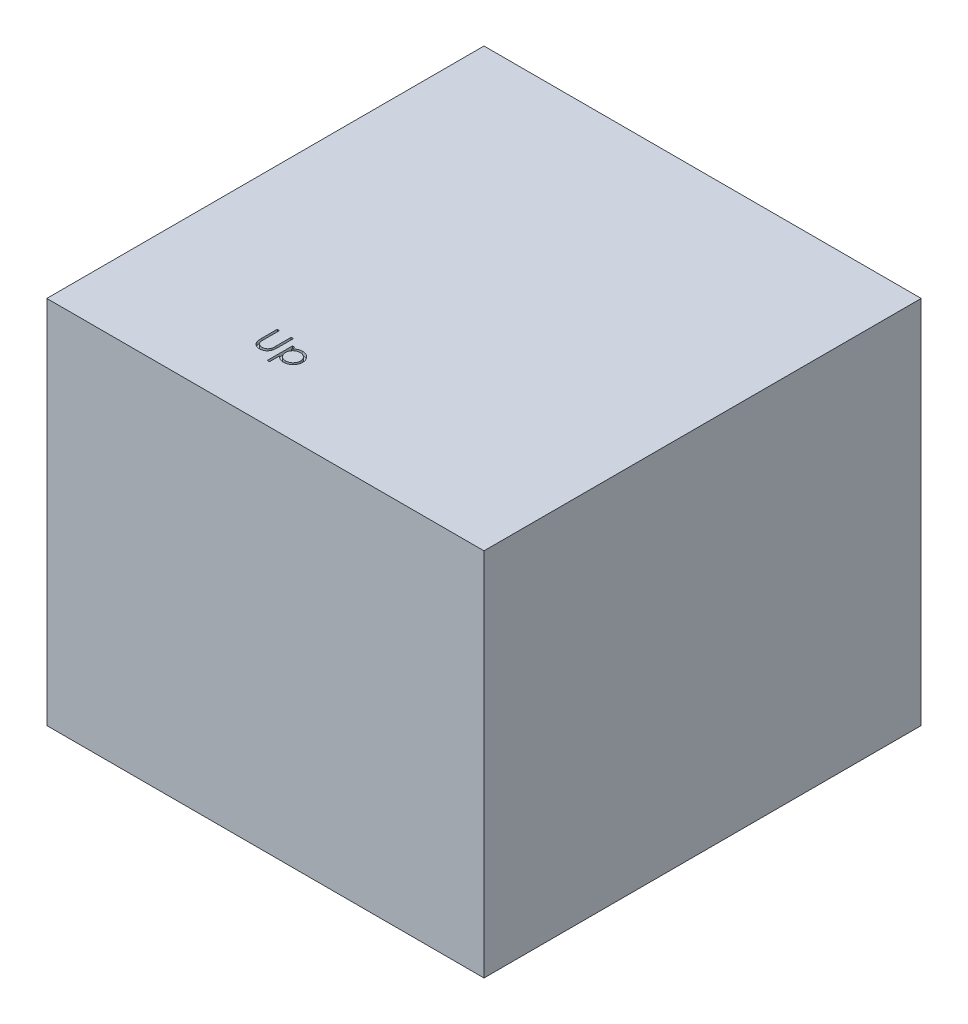
from build123d import *

# Parameters (mm, degrees)
SKETCH1_W           = 330.2
SKETCH1_H           = 330.2
BOSS_EXTRUDE1_DEPTH = 279.4
CUT_EXTRUDE1_DEPTH  = 2.54


with BuildPart() as part:
    # Sketch1 → Boss-Extrude1 (new body)
    with BuildSketch(Plane(origin=(0, 0, 0), x_dir=(1, 0, 0), z_dir=(0, 1, 0))):
        Rectangle(SKETCH1_W, SKETCH1_H)
    extrude(amount=BOSS_EXTRUDE1_DEPTH)

    # Sketch2 → Cut-Extrude1 (cut)
    # profile 1 of 2: a face of its own
    with BuildSketch(Plane(origin=(0, 279.4, 0), x_dir=(1, 0, 0), z_dir=(0, 1, 0))):
        with BuildLine():
            Line((-57.888961079, -98.222414931), (-56.179345694, -98.222414931))
            Line((-56.179345694, -98.222414931), (-56.179345694, -109.636387287))
            add(Edge.make_bspline(
                [(-56.179345694, -109.636387287), (-56.179600115, -109.797935292), (-56.180082922, -110.10450047), (-56.176857954, -110.540845077), (-56.167826249, -110.92877089), (-56.162132152, -111.269773224), (-56.149464808, -111.562287321), (-56.13913401, -111.807897941), (-56.125850408, -112.0054421), (-56.109885869, -112.120726855), (-56.103023579, -112.170281518)],
                knots=[0, 0, 0, 0, 1.528628734, 2.90083645, 4.128790002, 5.200304208, 6.127813768, 6.898992206, 7.526736466, 8, 8, 8, 8], degree=3))
            add(Edge.make_bspline(
                [(-56.103023579, -112.170281518), (-56.07484341, -112.349061758), (-56.020070925, -112.696548613), (-55.880481354, -113.191349404), (-55.685531813, -113.637290627), (-55.454520395, -114.048287797), (-55.150087182, -114.412901314), (-54.785396511, -114.748789024), (-54.343557514, -115.042549846), (-53.852281931, -115.311159265), (-53.322772282, -115.527050642), (-52.78169096, -115.690300239), (-52.237171317, -115.789789679), (-51.872629618, -115.801309699), (-51.69160531, -115.807030316)],
                knots=[0, 0, 0, 0, 1.035780045, 2.013197591, 2.933192213, 3.817615948, 4.702609284, 5.640816605, 6.646850145, 7.73207398, 8.84249596, 9.914020372, 10.964143139, 12, 12, 12, 12], degree=3))
            add(Edge.make_bspline(
                [(-51.69160531, -115.807030316), (-51.53619138, -115.801185502), (-51.22626115, -115.789529633), (-50.765760435, -115.717349558), (-50.317268415, -115.587262194), (-49.878570428, -115.419405794), (-49.467357213, -115.197622477), (-49.083399336, -114.941422622), (-48.740695637, -114.640917711), (-48.427959963, -114.308357265), (-48.155626955, -113.933127782), (-47.919564027, -113.523399631), (-47.726201467, -113.073006757), (-47.630714567, -112.756480544), (-47.581659396, -112.593869258)],
                knots=[0, 0, 0, 0, 0.994687771, 1.983630487, 2.973142513, 3.978332533, 4.983357753, 5.956394766, 6.925816176, 7.893390482, 8.871859704, 9.88551698, 10.913711441, 12, 12, 12, 12], degree=3))
            add(Edge.make_bspline(
                [(-47.581659396, -112.593869258), (-47.565330143, -112.526657732), (-47.528941986, -112.376883366), (-47.494940212, -112.123674627), (-47.459526124, -111.824919661), (-47.434953964, -111.478471937), (-47.41099875, -111.085492357), (-47.396667311, -110.643933727), (-47.390043175, -110.155399412), (-47.388069158, -109.814474289), (-47.387038002, -109.636387287)],
                knots=[0, 0, 0, 0, 0.558680831, 1.244966039, 2.062412453, 2.990489873, 4.051219941, 5.244515665, 6.560634259, 8, 8, 8, 8], degree=3))
            Line((-47.387038002, -109.636387287), (-47.387038002, -98.222414931))
            Line((-47.387038002, -98.222414931), (-45.677422617, -98.222414931))
            Line((-45.677422617, -98.222414931), (-45.677422617, -109.727973826))
            add(Edge.make_bspline(
                [(-45.677422617, -109.727973826), (-45.678805758, -109.93533786), (-45.681505042, -110.34002138), (-45.704912466, -110.933028062), (-45.742234136, -111.495563575), (-45.794965015, -112.027703534), (-45.864834989, -112.527543744), (-45.942532975, -112.999465411), (-46.041481577, -113.440080985), (-46.157051946, -113.852826001), (-46.2891694, -114.245721438), (-46.460299079, -114.618604041), (-46.653109572, -114.982809559), (-46.881789325, -115.332829409), (-47.138754137, -115.670213362), (-47.429683999, -115.992915328), (-47.744956932, -116.306092137), (-48.089813963, -116.601710397), (-48.458570394, -116.87281191), (-48.850129306, -117.111196921), (-49.261482867, -117.312711182), (-49.691561796, -117.478587285), (-50.140549629, -117.603308174), (-50.608457687, -117.696245808), (-51.096351011, -117.749054028), (-51.428172925, -117.756902247), (-51.596202666, -117.76087647)],
                knots=[0, 0, 0, 0, 1.316592851, 2.569410997, 3.76748051, 4.895814652, 5.963796859, 6.97159953, 7.931736103, 8.829262218, 9.692595152, 10.560224239, 11.431080259, 12.30701507, 13.211635791, 14.121146779, 15.063487852, 16.031507147, 17.00238618, 17.966455255, 18.938106653, 19.907068911, 20.888905087, 21.893141452, 22.933117798, 24, 24, 24, 24], degree=3))
            add(Edge.make_bspline(
                [(-51.596202666, -117.76087647), (-51.779458781, -117.756605105), (-52.139006624, -117.748224701), (-52.668803819, -117.700203733), (-53.176699659, -117.609752186), (-53.668058361, -117.494581636), (-54.136190324, -117.335738723), (-54.5873675, -117.1501475), (-55.013862607, -116.922215555), (-55.422594664, -116.668614373), (-55.802640837, -116.383274557), (-56.151513846, -116.072268753), (-56.469789656, -115.740578984), (-56.75210356, -115.384614136), (-57.003132946, -115.007142703), (-57.219378822, -114.60709684), (-57.405052336, -114.184631434), (-57.500882365, -113.890971871), (-57.549327666, -113.742517095)],
                knots=[0, 0, 0, 0, 1.13879206, 2.234305948, 3.301075583, 4.341971843, 5.366689343, 6.369221514, 7.369726634, 8.367512178, 9.355451585, 10.318319045, 11.268648973, 12.207971039, 13.137398894, 14.081662264, 15.030215811, 16, 16, 16, 16], degree=3))
            add(Edge.make_bspline(
                [(-57.549327666, -113.742517095), (-57.577506198, -113.641102654), (-57.638626062, -113.421132473), (-57.704078039, -113.057078871), (-57.759100326, -112.637897676), (-57.810837722, -112.163560196), (-57.841366479, -111.633698779), (-57.868131395, -111.048543109), (-57.889149635, -110.407385632), (-57.889025688, -109.960774625), (-57.888961079, -109.727973826)],
                knots=[0, 0, 0, 0, 0.625038921, 1.35572334, 2.194682327, 3.136881307, 4.189498639, 5.346923369, 6.617055217, 8, 8, 8, 8], degree=3))
            Line((-57.888961079, -109.727973826), (-57.888961079, -98.222414931))
        make_face()
    # profile 2 of 2: a face of its own
    with BuildSketch(Plane(origin=(0, 279.4, 0), x_dir=(1, 0, 0), z_dir=(0, 1, 0))):
        with BuildLine():
            Line((-41.281268771, -103.351261085), (-39.571653387, -103.351261085))
            Line((-39.571653387, -103.351261085), (-39.571653387, -105.927132479))
            add(Edge.make_bspline(
                [(-39.571653387, -105.927132479), (-39.390093366, -105.693428528), (-39.037267801, -105.239271668), (-38.429165104, -104.651496825), (-37.78730633, -104.155786958), (-37.095174042, -103.767262029), (-36.363525101, -103.474323038), (-35.595362059, -103.257809175), (-34.784165353, -103.130220578), (-34.229557517, -103.114862679), (-33.946713483, -103.107030316)],
                knots=[0, 0, 0, 0, 1.0828784, 2.104357462, 3.088488658, 4.04616522, 5.001424249, 5.969181776, 6.964304535, 8, 8, 8, 8], degree=3))
            add(Edge.make_bspline(
                [(-33.946713483, -103.107030316), (-33.699653471, -103.114177761), (-33.211326379, -103.128305062), (-32.49252509, -103.223952687), (-31.800327646, -103.387878985), (-31.138650095, -103.624103967), (-30.500403983, -103.916143025), (-29.895037982, -104.284717175), (-29.313122772, -104.711470871), (-28.769293229, -105.202591578), (-28.266801214, -105.733968285), (-27.832209857, -106.305589683), (-27.457349921, -106.898657475), (-27.15434445, -107.522365862), (-26.916990445, -108.171803385), (-26.748181985, -108.849593899), (-26.647719668, -109.553224375), (-26.634240696, -110.031666325), (-26.627422617, -110.273676951)],
                knots=[0, 0, 0, 0, 1.041296284, 2.058176809, 3.050446431, 4.034000596, 5.01514041, 6.003636468, 7.015969324, 8.052561599, 9.08815499, 10.094063707, 11.074456064, 12.040834395, 13.011057502, 13.983766392, 14.980127149, 16, 16, 16, 16], degree=3))
            add(Edge.make_bspline(
                [(-26.627422617, -110.273676951), (-26.63409276, -110.52079523), (-26.647247245, -111.008148139), (-26.749273634, -111.723813625), (-26.91232462, -112.412266331), (-27.14668416, -113.072361151), (-27.449532832, -113.703643596), (-27.818039082, -114.305658409), (-28.25284971, -114.878212708), (-28.749788705, -115.413533493), (-29.288919686, -115.90665261), (-29.865195736, -116.337934103), (-30.469673602, -116.700109303), (-31.099260683, -117.002639411), (-31.759346659, -117.230652585), (-32.446851784, -117.395123757), (-33.161401753, -117.496548655), (-33.647455166, -117.509895316), (-33.893288002, -117.516645701)],
                knots=[0, 0, 0, 0, 1.038740735, 2.04854663, 3.033179607, 4.009277356, 4.987731542, 5.972001279, 6.972200261, 8.005528982, 9.039189865, 10.040446548, 11.026516639, 11.997840187, 12.972163198, 13.956796175, 14.96660207, 16, 16, 16, 16], degree=3))
            add(Edge.make_bspline(
                [(-33.893288002, -117.516645701), (-34.169935215, -117.509598247), (-34.716394567, -117.49567746), (-35.515393316, -117.354601814), (-36.284343039, -117.143762207), (-37.014724528, -116.835157685), (-37.712323622, -116.441881234), (-38.373194279, -115.96230997), (-39.000846891, -115.397446856), (-39.378628841, -114.968920828), (-39.571653387, -114.749969018)],
                knots=[0, 0, 0, 0, 1.014726462, 2.004382257, 2.969841629, 3.936926163, 4.907207904, 5.903978561, 6.929055279, 8, 8, 8, 8], degree=3))
            Line((-39.571653387, -114.749969018), (-39.571653387, -122.401261085))
            Line((-39.571653387, -122.401261085), (-41.281268771, -122.401261085))
            Line((-41.281268771, -122.401261085), (-41.281268771, -103.351261085))
        make_face()
        with BuildLine():
            add(Edge.make_bspline(
                [(-33.961977906, -104.816645701), (-34.155632382, -104.820130534), (-34.536888129, -104.826991274), (-35.09571835, -104.908492338), (-35.633992035, -105.026807758), (-36.146284371, -105.20594253), (-36.637505583, -105.425827499), (-37.103872252, -105.700593874), (-37.545057012, -106.02527122), (-37.959949849, -106.39364022), (-38.334762918, -106.799539594), (-38.666575426, -107.23272467), (-38.945289472, -107.692646858), (-39.176621896, -108.175022046), (-39.352661764, -108.683631383), (-39.477606467, -109.215578209), (-39.556148816, -109.771444759), (-39.566430032, -110.150028165), (-39.571653387, -110.342366854)],
                knots=[0, 0, 0, 0, 1.05670511, 2.080379991, 3.077984906, 4.06214886, 5.038337365, 6.01289324, 7.01187578, 8.025460281, 9.038092164, 10.024533457, 11.000252242, 11.969694649, 12.940728589, 13.933144304, 14.949937299, 16, 16, 16, 16], degree=3))
            add(Edge.make_bspline(
                [(-39.571653387, -110.342366854), (-39.562994584, -110.594850724), (-39.546031257, -111.089488008), (-39.408123583, -111.812213015), (-39.183685931, -112.496117025), (-38.865122504, -113.13544067), (-38.462636421, -113.723175815), (-37.977687884, -114.249448973), (-37.414664856, -114.710952047), (-36.782927713, -115.099687728), (-36.10571583, -115.415308489), (-35.399309652, -115.641264406), (-34.673423657, -115.780450392), (-34.182650374, -115.798122364), (-33.935265166, -115.807030316)],
                knots=[0, 0, 0, 0, 1.03728447, 2.032128127, 3.01272805, 3.987917167, 4.958271349, 5.931593992, 6.91984656, 7.941419022, 8.973179163, 9.983609215, 10.983593296, 12, 12, 12, 12], degree=3))
            add(Edge.make_bspline(
                [(-33.935265166, -115.807030316), (-33.692863343, -115.798559179), (-33.211739303, -115.781745495), (-32.503307241, -115.636213359), (-31.814836766, -115.413899726), (-31.160713256, -115.089725569), (-30.54663113, -114.69245111), (-29.992104388, -114.215874358), (-29.507652473, -113.663479096), (-29.094733627, -113.048389959), (-28.762003685, -112.388849656), (-28.512011951, -111.70641667), (-28.367729573, -111.003496581), (-28.34728191, -110.529980458), (-28.337038002, -110.292757479)],
                knots=[0, 0, 0, 0, 1.00104056, 1.986885549, 2.97790532, 3.984399681, 4.995088187, 5.994304198, 6.996462723, 8.023150851, 9.048424203, 10.043036403, 11.019596776, 12, 12, 12, 12], degree=3))
            add(Edge.make_bspline(
                [(-28.337038002, -110.292757479), (-28.344955911, -110.054061039), (-28.360730039, -109.578527843), (-28.516107487, -108.877689757), (-28.749605937, -108.192499487), (-29.09010592, -107.541966209), (-29.493972829, -106.928152988), (-29.982452913, -106.386295446), (-30.530092496, -105.911837927), (-31.143443517, -105.51986834), (-31.801704976, -105.208071574), (-32.494661875, -104.980104911), (-33.218799197, -104.843087789), (-33.712072574, -104.825537262), (-33.961977906, -104.816645701)],
                knots=[0, 0, 0, 0, 0.983928682, 1.960191568, 2.949917689, 3.96440592, 4.982380491, 5.975291189, 6.965713506, 7.964880129, 8.970154049, 9.96478489, 10.968906225, 12, 12, 12, 12], degree=3))
        make_face(mode=Mode.SUBTRACT)
    extrude(amount=-CUT_EXTRUDE1_DEPTH, mode=Mode.SUBTRACT)


solid = part.part
